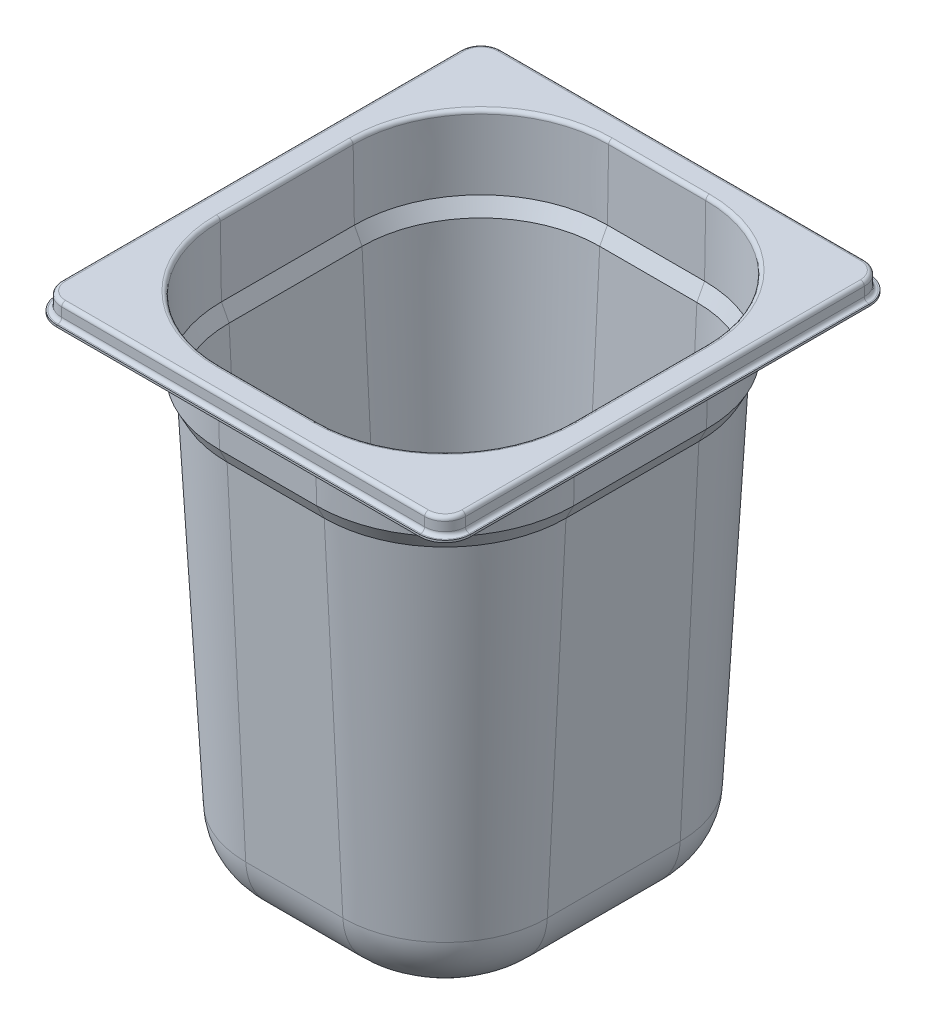
from build123d import *

# Parameters (mm, degrees)
BOSS_EXTRUDE2_DEPTH = 0.8
BOSS_EXTRUDE3_START = -0.8
BOSS_EXTRUDE3_DEPTH = 0.8


with BuildPart() as part:
    # Sweep9: sweep along a path in Sketch1
    with BuildLine(Plane(origin=(0, 0, 0), x_dir=(1, 0, 0), z_dir=(0, 1, 0))) as sweep9_path:
        Line((10, 0), (152, 0))
        ThreePointArc((152, 0), (159.071067812, 2.928932188), (162, 10))
        Line((162, 10), (162, 166))
        ThreePointArc((162, 166), (159.071067812, 173.071067812), (152, 176))
        Line((152, 176), (10, 176))
        ThreePointArc((10, 176), (2.928932188, 173.071067812), (0, 166))
        Line((0, 166), (0, 10))
        ThreePointArc((0, 10), (2.928932188, 2.928932188), (10, 0))
    # Sketch7 → Sweep9 (sweep)
    with BuildSketch(Plane.XY.offset(-10)):
        with BuildLine():
            Line((2, -5), (2, -1.5))
            ThreePointArc((2, -1.5), (2.439339828, -0.439339828), (3.5, 0))
            Line((3.5, 0), (3.5, -0.8))
            ThreePointArc((3.5, -0.8), (3.005025253, -1.005025253), (2.8, -1.5))
            Line((2.8, -1.5), (2.8, -5))
            ThreePointArc((2.8, -5), (2.126345597, -6.626345597), (0.5, -7.3))
            Line((0.5, -7.3), (0, -7.3))
            Line((0, -7.3), (0, -6.5))
            Line((0, -6.5), (0.5, -6.5))
            ThreePointArc((0.5, -6.5), (1.560660172, -6.060660172), (2, -5))
        make_face()
    sweep(path=sweep9_path.line)



with BuildPart() as body_2:
    # Sweep10: sweep along a path in Sketch9
    with BuildLine(Plane(origin=(0, 0, 0), x_dir=(1, 0, 0), z_dir=(0, 1, 0))) as sweep10_path:
        Line((62, 164), (100, 164))
        ThreePointArc((100, 164), (135.355339059, 149.355339059), (150, 114))
        Line((150, 114), (150, 62))
        ThreePointArc((150, 62), (135.355339059, 26.644660941), (100, 12))
        Line((100, 12), (62, 12))
        ThreePointArc((62, 12), (26.644660941, 26.644660941), (12, 62))
        Line((12, 62), (12, 114))
        ThreePointArc((12, 114), (26.644660941, 149.355339059), (62, 164))
    # Sketch10 → Sweep10 (sweep)
    with BuildSketch(Plane.XY.offset(-62)):
        with BuildLine():
            Line((10.527782042, 0), (10.527782042, -0.8))
            ThreePointArc((10.527782042, -0.8), (11.018418527, -1.000724686), (11.227675428, -1.487783315))
            Line((11.227675428, -1.487783315), (11.702739993, -28.704213986))
            Line((11.702739993, -28.704213986), (14.709583225, -34.417216127))
            Line((14.709583225, -34.417216127), (22.001237481, -173.550267671))
            ThreePointArc((22.001237481, -173.550267671), (30.006331425, -190.914658772), (47.765879478, -198))
            Line((47.765879478, -198), (57.765879478, -198))
            Line((57.765879478, -198), (57.765879478, -197.2))
            Line((57.765879478, -197.2), (47.765879478, -197.2))
            ThreePointArc((47.765879478, -197.2), (30.557015086, -190.334359275), (22.800141109, -173.508398906))
            Line((22.800141109, -173.508398906), (15.499297287, -34.2))
            Line((15.499297287, -34.2), (12.499297287, -28.5))
            Line((12.499297287, -28.5), (12.027553585, -1.47382139))
            ThreePointArc((12.027553585, -1.47382139), (11.579145938, -0.430124326), (10.527782042, 0))
        make_face()
    sweep(path=sweep10_path.line)


with BuildPart() as part_1:
    add(part.part)

    add(body_2.part)  # Boss-Extrude2 merges body 2
    # Sketch11 → Boss-Extrude2 (add)
    with BuildSketch(Plane(origin=(0, 0, 0), x_dir=(1, 0, 0), z_dir=(0, 1, 0))):
        with BuildLine():
            Line((158.5, 166), (158.5, 10))
            ThreePointArc((158.5, 10), (156.596194078, 5.403805922), (152, 3.5))
            Line((152, 3.5), (10, 3.5))
            ThreePointArc((10, 3.5), (5.403805922, 5.403805922), (3.5, 10))
            Line((3.5, 10), (3.5, 166))
            ThreePointArc((3.5, 166), (5.403805922, 170.596194078), (10, 172.5))
            Line((10, 172.5), (152, 172.5))
            ThreePointArc((152, 172.5), (156.596194078, 170.596194078), (158.5, 166))
        make_face()
        with BuildLine():
            Line((10.527782042, 62), (10.527782042, 114))
            ThreePointArc((10.527782042, 114), (25.603645639, 150.396354361), (62, 165.472217958))
            Line((62, 165.472217958), (100, 165.472217958))
            ThreePointArc((100, 165.472217958), (136.396354361, 150.396354361), (151.472217958, 114))
            Line((151.472217958, 114), (151.472217958, 62))
            ThreePointArc((151.472217958, 62), (136.396354361, 25.603645639), (100, 10.527782042))
            Line((100, 10.527782042), (62, 10.527782042))
            ThreePointArc((62, 10.527782042), (25.603645639, 25.603645639), (10.527782042, 62))
        make_face(mode=Mode.SUBTRACT)
    extrude(amount=-BOSS_EXTRUDE2_DEPTH)

    # Sketch12 → Boss-Extrude3 (add)
    with BuildSketch(Plane(origin=(0, -198, 0), x_dir=(-1, 0, 0), z_dir=(0, -1, 0)).offset(BOSS_EXTRUDE3_START)):
        with BuildLine():
            Line((-62, 118.234120522), (-100, 118.234120522))
            ThreePointArc((-100, 118.234120522), (-102.993975333, 116.993975333), (-104.234120522, 114))
            Line((-104.234120522, 114), (-104.234120522, 62))
            ThreePointArc((-104.234120522, 62), (-102.993975333, 59.006024667), (-100, 57.765879478))
            Line((-100, 57.765879478), (-62, 57.765879478))
            ThreePointArc((-62, 57.765879478), (-59.006024667, 59.006024667), (-57.765879478, 62))
            Line((-57.765879478, 62), (-57.765879478, 114))
            ThreePointArc((-57.765879478, 114), (-59.006024667, 116.993975333), (-62, 118.234120522))
        make_face()
    extrude(amount=BOSS_EXTRUDE3_DEPTH)


solid = part_1.part
